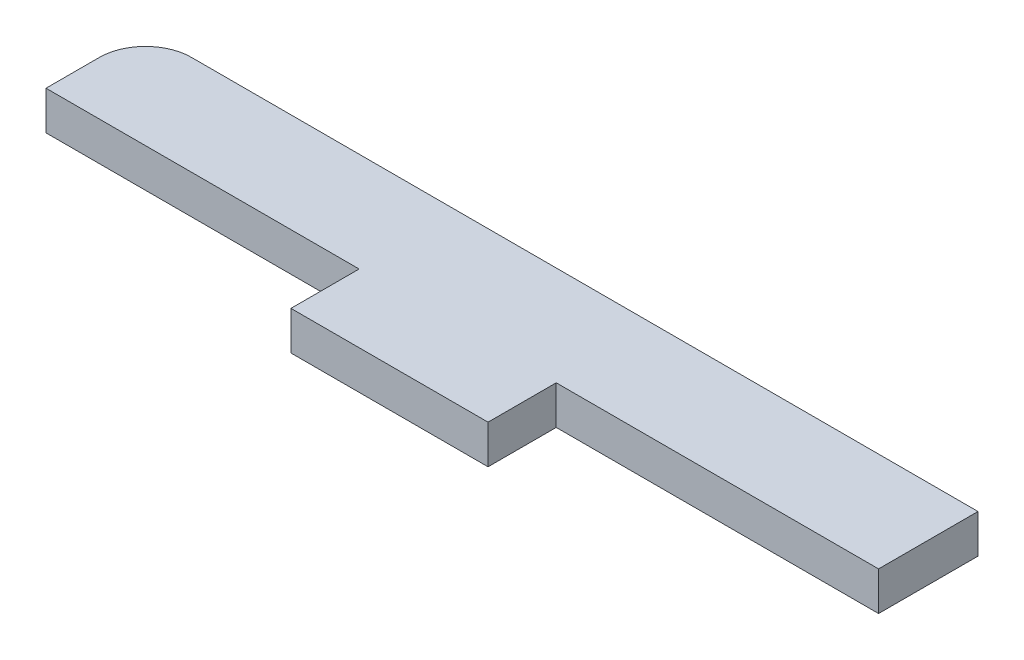
from build123d import *

# Parameters (mm, degrees)
SKETCH1_W           = 114.808
SKETCH1_H           = 23.114
BOSS_EXTRUDE1_DEPTH = 5.334
FILLET1_R           = 6.35
SKETCH3_W           = 43.18
SKETCH3_H           = 9.401705223
SKETCH3_W_2         = 44.45
CUT_EXTRUDE2_DEPTH  = 474.106416887


with BuildPart() as part:
    # Sketch1 → Boss-Extrude1 (new body)
    with BuildSketch(Plane(origin=(0, 0, 0), x_dir=(1, 0, 0), z_dir=(0, 1, 0))):
        with Locations((-373.645654051, 183.372284322)):
            Rectangle(SKETCH1_W, SKETCH1_H)
    extrude(amount=BOSS_EXTRUDE1_DEPTH)

    # Fillet1
    fillet1_edges = [part.edges().sort_by_distance(p)[0] for p in [
        (-431.049654051, 2.667, -194.929284322),
    ]]
    fillet(fillet1_edges, radius=FILLET1_R)

    # Sketch3 → Cut-Extrude2 (cut, through all)
    with BuildSketch(Plane(origin=(0, 5.334, 0), x_dir=(1, 0, 0), z_dir=(0, 1, 0))):
        with Locations((-409.459654051, 176.516136934)):
            Rectangle(SKETCH3_W, SKETCH3_H)
        with Locations((-338.466654051, 176.516136934)):
            Rectangle(SKETCH3_W_2, SKETCH3_H)
    extrude(amount=-CUT_EXTRUDE2_DEPTH, mode=Mode.SUBTRACT)


solid = part.part
